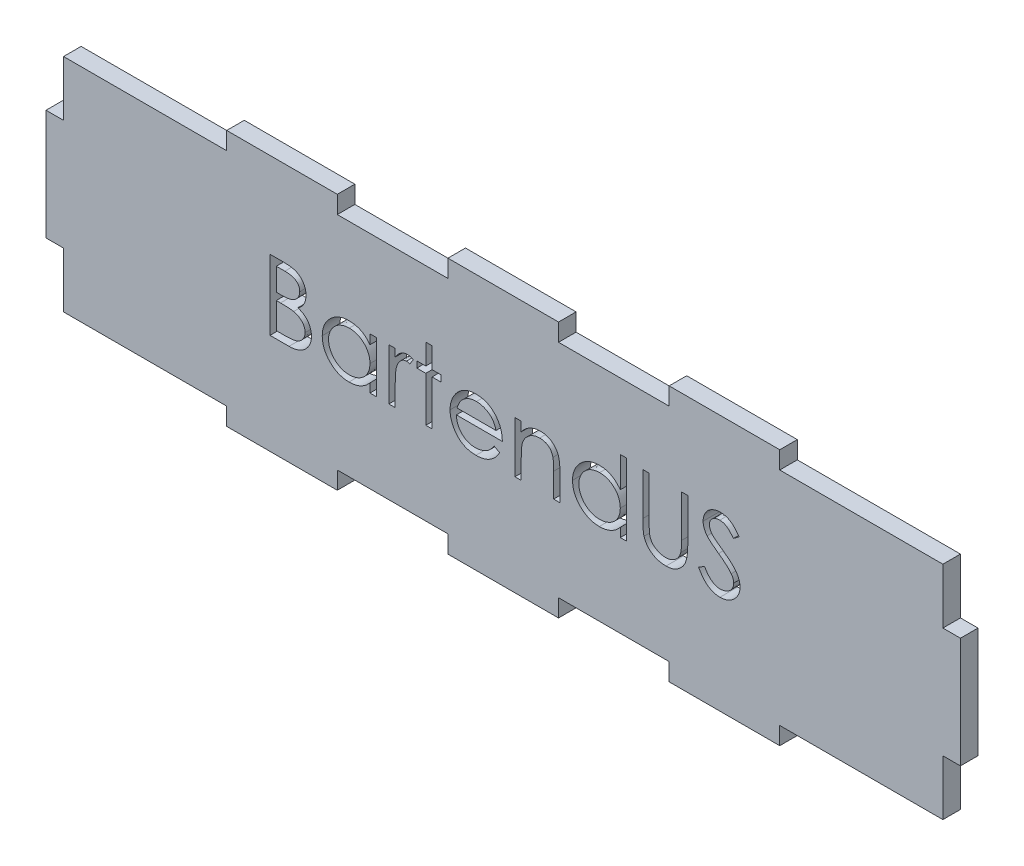
from build123d import *

# Parameters (mm, degrees)
ESQUISSE1_W             = 165.35
ESQUISSE1_H             = 46.35
BOSS_EXTRU_1_DEPTH      = 3.175
ESQUISSE3_W             = 3.175
ESQUISSE3_H             = 13.175
ENL_V_MAT_EXTRU_1_DEPTH = 86.920410119
ESQUISSE5_W             = 20
ESQUISSE5_H             = 3.175
ESQUISSE5_W_2           = 29.5
ENL_V_MAT_EXTRU_2_DEPTH = 86.920410119
ENL_V_MAT_EXTRU_3_DEPTH = 86.920410119


with BuildPart() as part:
    # Esquisse1 → Boss.-Extru.1 (new body)
    with BuildSketch(Plane.XY):
        Rectangle(ESQUISSE1_W, ESQUISSE1_H)
    extrude(amount=BOSS_EXTRU_1_DEPTH)

    # Esquisse3 → Enlèv. mat.-Extru.1 (cut, through all)
    with BuildSketch(Plane.XY.offset(3.175)):
        with Locations((-81.0875, -16.5875)):
            Rectangle(ESQUISSE3_W, ESQUISSE3_H)
        with Locations((-81.0875, 16.5875)):
            Rectangle(ESQUISSE3_W, ESQUISSE3_H)
    enl_v_mat_extru_1 = extrude(amount=-ENL_V_MAT_EXTRU_1_DEPTH, mode=Mode.SUBTRACT)

    # Symétrie1: Enlèv. mat.-Extru.1 across plane
    add(enl_v_mat_extru_1.mirror(Plane(origin=(0, 0, 0), x_dir=(0, 0, 1), z_dir=(1, 0, 0))), mode=Mode.SUBTRACT)

    # Esquisse5 → Enlèv. mat.-Extru.2 (cut, through all)
    with BuildSketch(Plane.XY.offset(3.175)):
        with Locations((-20, -21.5875)):
            Rectangle(ESQUISSE5_W, ESQUISSE5_H)
        with Locations((20, -21.5875)):
            Rectangle(ESQUISSE5_W, ESQUISSE5_H)
        with Locations((64.75, -21.5875)):
            Rectangle(ESQUISSE5_W_2, ESQUISSE5_H)
        with Locations((-64.75, -21.5875)):
            Rectangle(ESQUISSE5_W_2, ESQUISSE5_H)
    enl_v_mat_extru_2 = extrude(amount=-ENL_V_MAT_EXTRU_2_DEPTH, mode=Mode.SUBTRACT)

    # Symétrie2: Enlèv. mat.-Extru.2 across plane
    add(enl_v_mat_extru_2.mirror(Plane.ZX), mode=Mode.SUBTRACT)

    # Esquisse9 → Enlèv. mat.-Extru.3 (cut, through all)
    # profile 1 of 9: a face of its own
    with BuildSketch(Plane.XY.offset(3.175)):
        with BuildLine():
            Line((-42.170512821, 7.7), (-39.692588141, 7.7))
            add(Edge.make_bspline(
                [(-39.692588141, 7.7), (-39.57129052, 7.699362277), (-39.336185543, 7.698126211), (-38.994303568, 7.678955993), (-38.674086455, 7.652816962), (-38.375441338, 7.611342054), (-38.098506218, 7.561297606), (-37.842446506, 7.500693873), (-37.608076452, 7.428025875), (-37.32826738, 7.312469369), (-37.009240982, 7.140753872), (-36.663806814, 6.887013079), (-36.368425717, 6.576652427), (-36.113749652, 6.22655822), (-35.911271304, 5.841436991), (-35.764788425, 5.430467935), (-35.672049848, 4.9989519), (-35.662512387, 4.702703797), (-35.657692308, 4.552984776)],
                knots=[0, 0, 0, 0, 1.001505555, 1.941167018, 2.826882275, 3.653841531, 4.429895133, 5.150066043, 5.825578002, 6.45369114, 7.647487171, 8.808567382, 9.977351308, 11.170798116, 12.373658725, 13.556498008, 14.765093433, 16, 16, 16, 16], degree=3))
            add(Edge.make_bspline(
                [(-35.657692308, 4.552984776), (-35.661659129, 4.412731216), (-35.669454307, 4.137119746), (-35.743995176, 3.734006835), (-35.860692459, 3.350280984), (-36.022908649, 2.987342614), (-36.233735892, 2.653392075), (-36.48359322, 2.345735424), (-36.785043332, 2.077398731), (-37.010897374, 1.927383056), (-37.125620994, 1.851181891)],
                knots=[0, 0, 0, 0, 1.044552857, 2.05264487, 3.044412934, 4.028983338, 5.005914585, 5.980388656, 6.974128949, 8, 8, 8, 8], degree=3))
            add(Edge.make_bspline(
                [(-37.125620994, 1.851181891), (-36.981347442, 1.795791752), (-36.705316399, 1.689816695), (-36.325455725, 1.502453726), (-35.998177287, 1.298665496), (-35.720964786, 1.076118497), (-35.483882438, 0.836237955), (-35.276861765, 0.575506541), (-35.100217921, 0.290523048), (-34.948859599, -0.015741209), (-34.830754113, -0.340158966), (-34.742304402, -0.67968721), (-34.691622516, -1.033108453), (-34.684410217, -1.273629687), (-34.680769231, -1.395052083)],
                knots=[0, 0, 0, 0, 1.27268992, 2.434971085, 3.483601985, 4.442670788, 5.356604649, 6.2567628, 7.179492994, 8.113709626, 9.066344395, 10.018646069, 10.999752585, 12, 12, 12, 12], degree=3))
            add(Edge.make_bspline(
                [(-34.680769231, -1.395052083), (-34.684313786, -1.519029019), (-34.691287799, -1.762957114), (-34.742740839, -2.121297174), (-34.829859599, -2.463743409), (-34.949860616, -2.792510786), (-35.106478157, -3.106963274), (-35.297079628, -3.407457117), (-35.52434273, -3.690973117), (-35.778570855, -3.960661692), (-36.066179211, -4.203151092), (-36.376479236, -4.419108085), (-36.71337874, -4.596712367), (-37.071344547, -4.745904788), (-37.454392208, -4.859868051), (-37.860801669, -4.939597105), (-38.290222421, -4.993318239), (-38.584897804, -4.997734954), (-38.736017628, -5)],
                knots=[0, 0, 0, 0, 0.978564426, 1.925352924, 2.850884081, 3.763762016, 4.682927383, 5.618979971, 6.567305752, 7.547517671, 8.540179244, 9.531824382, 10.526200242, 11.540722885, 12.589160233, 13.674978461, 14.80764778, 16, 16, 16, 16], degree=3))
            Line((-38.736017628, -5), (-42.170512821, -5))
            Line((-42.170512821, -5), (-42.170512821, 7.7))
        make_face()
        with BuildLine():
            Line((-41.030769231, 6.397435897), (-41.030769231, 2.326923077))
            Line((-41.030769231, 2.326923077), (-40.265004006, 2.326923077))
            add(Edge.make_bspline(
                [(-40.265004006, 2.326923077), (-40.153066949, 2.328374226), (-39.936781743, 2.331178142), (-39.623563832, 2.339210047), (-39.33282448, 2.36170009), (-39.065065543, 2.38418367), (-38.820708675, 2.420740031), (-38.600295235, 2.464254305), (-38.40036604, 2.510275132), (-38.169808261, 2.588541556), (-37.908286419, 2.704211977), (-37.629492013, 2.883724068), (-37.383712652, 3.097535293), (-37.17616857, 3.344245354), (-37.006309806, 3.615902657), (-36.888331468, 3.908172766), (-36.808331323, 4.213771531), (-36.801104909, 4.423569191), (-36.797435897, 4.530088141)],
                knots=[0, 0, 0, 0, 1.156816544, 2.235205308, 3.236616184, 4.169592532, 5.011045266, 5.787822928, 6.49130361, 7.128639758, 8.301311294, 9.436451833, 10.541879658, 11.654887649, 12.756523258, 13.837046038, 14.901820046, 16, 16, 16, 16], degree=3))
            add(Edge.make_bspline(
                [(-36.797435897, 4.530088141), (-36.79934518, 4.600575941), (-36.803090446, 4.738845456), (-36.833763858, 4.940410256), (-36.885897628, 5.129980443), (-36.952860349, 5.31015393), (-37.046436448, 5.475296929), (-37.156612444, 5.631119382), (-37.289729091, 5.772314783), (-37.441248483, 5.904284106), (-37.6154512, 6.021285678), (-37.812233316, 6.123759304), (-38.034257173, 6.206275837), (-38.277780961, 6.278543019), (-38.546553193, 6.329300542), (-38.837472287, 6.371585692), (-39.152921124, 6.39311307), (-39.371161925, 6.395962815), (-39.483974359, 6.397435897)],
                knots=[0, 0, 0, 0, 0.91205012, 1.789085906, 2.630437955, 3.453916878, 4.269457761, 5.079663411, 5.91843418, 6.774407191, 7.675494373, 8.627863946, 9.638891023, 10.736472738, 11.911756761, 13.175263542, 14.539845004, 16, 16, 16, 16], degree=3))
            Line((-39.483974359, 6.397435897), (-41.030769231, 6.397435897))
        make_face(mode=Mode.SUBTRACT)
        with BuildLine():
            Line((-41.030769231, 1.024358974), (-41.030769231, -3.697435897))
            Line((-41.030769231, -3.697435897), (-39.407652244, -3.697435897))
            add(Edge.make_bspline(
                [(-39.407652244, -3.697435897), (-39.291469284, -3.696043443), (-39.067541946, -3.693359669), (-38.744231768, -3.684598286), (-38.444573077, -3.664669171), (-38.16993327, -3.633297088), (-37.91734677, -3.599266715), (-37.689843677, -3.553505782), (-37.485579803, -3.501076696), (-37.248727315, -3.420035557), (-36.982014585, -3.294136934), (-36.694592335, -3.104311027), (-36.439045772, -2.878166453), (-36.222038117, -2.616434279), (-36.044190987, -2.331840607), (-35.914812621, -2.030141765), (-35.835017227, -1.716322852), (-35.825357356, -1.502357923), (-35.820512821, -1.395052083)],
                knots=[0, 0, 0, 0, 1.160039823, 2.235823828, 3.228722157, 4.157150951, 4.99529583, 5.772374946, 6.472645482, 7.099169577, 8.269452708, 9.405989375, 10.527446681, 11.663510218, 12.788923519, 13.866172445, 14.929861265, 16, 16, 16, 16], degree=3))
            add(Edge.make_bspline(
                [(-35.820512821, -1.395052083), (-35.821514685, -1.327947676), (-35.823502253, -1.194821262), (-35.853476485, -0.999183861), (-35.897069669, -0.80967855), (-35.953426586, -0.625790748), (-36.035502939, -0.450845069), (-36.131320973, -0.281381495), (-36.243666631, -0.117176013), (-36.418724033, 0.090422735), (-36.673348091, 0.329607325), (-37.035141247, 0.563786262), (-37.446520728, 0.752645448), (-37.74488906, 0.832834976), (-37.899018429, 0.874258814)],
                knots=[0, 0, 0, 0, 0.723448775, 1.435228256, 2.130040452, 2.821711965, 3.505591119, 4.210454504, 4.921174351, 5.648778258, 7.137944449, 8.670945889, 10.280296675, 12, 12, 12, 12], degree=3))
            add(Edge.make_bspline(
                [(-37.899018429, 0.874258814), (-37.96080972, 0.886795833), (-38.094785984, 0.913978676), (-38.31325349, 0.942672343), (-38.5626665, 0.968235846), (-38.84360094, 0.987144903), (-39.156412249, 1.006690361), (-39.501768497, 1.01429157), (-39.878259325, 1.023360313), (-40.13948879, 1.024017572), (-40.275180288, 1.024358974)],
                knots=[0, 0, 0, 0, 0.634451884, 1.375622551, 2.216452059, 3.157844607, 4.20941857, 5.370758133, 6.634282058, 8, 8, 8, 8], degree=3))
            Line((-40.275180288, 1.024358974), (-41.030769231, 1.024358974))
        make_face(mode=Mode.SUBTRACT)
    # profile 2 of 9: a face of its own
    with BuildSketch(Plane.XY.offset(3.175)):
        with BuildLine():
            Line((-22.957692308, 4.280769231), (-22.957692308, -5))
            Line((-22.957692308, -5), (-24.097435897, -5))
            Line((-24.097435897, -5), (-24.097435897, -3.394691506))
            add(Edge.make_bspline(
                [(-24.097435897, -3.394691506), (-24.225955509, -3.539978033), (-24.476763147, -3.823506517), (-24.89564949, -4.193918971), (-25.339671164, -4.500091738), (-25.806673101, -4.747378575), (-26.296233584, -4.933132608), (-26.807267386, -5.065162385), (-27.339982968, -5.150048587), (-27.703755798, -5.158525009), (-27.888100962, -5.162820513)],
                knots=[0, 0, 0, 0, 1.074387032, 2.096679803, 3.090159297, 4.057316773, 5.018401886, 5.985159533, 6.978961417, 8, 8, 8, 8], degree=3))
            add(Edge.make_bspline(
                [(-27.888100962, -5.162820513), (-28.051996108, -5.158370533), (-28.375204595, -5.149594977), (-28.85065296, -5.081514618), (-29.308187694, -4.972183505), (-29.748241143, -4.820143135), (-30.167965785, -4.618464154), (-30.570955279, -4.377014482), (-30.955121904, -4.08948347), (-31.31461006, -3.760778339), (-31.64565189, -3.403745099), (-31.936159936, -3.022942687), (-32.178378255, -2.620017755), (-32.380925405, -2.20007174), (-32.536940712, -1.759871889), (-32.645702184, -1.300940451), (-32.713703234, -0.823820053), (-32.722475163, -0.498919497), (-32.726923077, -0.334174679)],
                knots=[0, 0, 0, 0, 1.033919861, 2.038935746, 3.024066025, 3.998881131, 4.97069526, 5.957263378, 6.95902576, 7.993208707, 9.027059324, 10.027763471, 11.009749337, 11.988697705, 12.965288445, 13.950418724, 14.960734635, 16, 16, 16, 16], degree=3))
            add(Edge.make_bspline(
                [(-32.726923077, -0.334174679), (-32.722376581, -0.172834955), (-32.713388403, 0.146124976), (-32.646429577, 0.615221966), (-32.533831345, 1.067045369), (-32.37581487, 1.500140563), (-32.173188347, 1.915031603), (-31.926706432, 2.312011922), (-31.636351322, 2.692175164), (-31.301606874, 3.046582187), (-30.938986422, 3.37395413), (-30.551060455, 3.658466952), (-30.147478835, 3.904182375), (-29.721981625, 4.098867846), (-29.280866702, 4.256380883), (-28.820207056, 4.365357653), (-28.341919327, 4.429573647), (-28.017196685, 4.43887282), (-27.852483974, 4.443589744)],
                knots=[0, 0, 0, 0, 1.020392517, 2.01726096, 2.990465484, 3.961182959, 4.928053699, 5.906110375, 6.912531644, 7.948652711, 8.985773172, 9.998621852, 10.987621588, 11.969261332, 12.953316658, 13.946091881, 14.958173133, 16, 16, 16, 16], degree=3))
            add(Edge.make_bspline(
                [(-27.852483974, 4.443589744), (-27.663073057, 4.438372759), (-27.291647188, 4.4281425), (-26.748348412, 4.343006318), (-26.234381306, 4.199175308), (-25.745778372, 4.003531815), (-25.284294168, 3.743549284), (-24.854297625, 3.41559914), (-24.451288585, 3.02174969), (-24.217680098, 2.719234077), (-24.097435897, 2.563521635)],
                knots=[0, 0, 0, 0, 1.038897134, 2.037228247, 3.008116434, 3.962042015, 4.918381754, 5.904844433, 6.921570401, 8, 8, 8, 8], degree=3))
            Line((-24.097435897, 2.563521635), (-24.097435897, 4.280769231))
            Line((-24.097435897, 4.280769231), (-22.957692308, 4.280769231))
        make_face()
        with BuildLine():
            add(Edge.make_bspline(
                [(-27.837219551, 3.303846154), (-28.003823006, 3.297918383), (-28.332671726, 3.286217905), (-28.81543139, 3.19487408), (-29.277397207, 3.042892837), (-29.716258677, 2.835041367), (-30.125083348, 2.573679952), (-30.490457525, 2.257553789), (-30.815369613, 1.895288052), (-31.088631029, 1.488517538), (-31.311390832, 1.05244275), (-31.468025491, 0.596605503), (-31.571328189, 0.129227442), (-31.581881963, -0.187774304), (-31.587179487, -0.346895032)],
                knots=[0, 0, 0, 0, 1.031046209, 2.035121221, 3.029706178, 4.034933723, 5.034054252, 6.02443088, 7.017295772, 8.038157696, 9.050218397, 10.03989886, 11.016116709, 12, 12, 12, 12], degree=3))
            add(Edge.make_bspline(
                [(-31.587179487, -0.346895032), (-31.580412589, -0.50506485), (-31.566905315, -0.820784512), (-31.46983851, -1.288799748), (-31.306988684, -1.744744415), (-31.084767485, -2.184748591), (-30.806504589, -2.593268041), (-30.483965764, -2.962439343), (-30.114031886, -3.279901563), (-29.704266361, -3.545649331), (-29.266631725, -3.760324763), (-28.806405745, -3.909697227), (-28.332239858, -4.006136602), (-28.009832818, -4.017401418), (-27.847395833, -4.023076923)],
                knots=[0, 0, 0, 0, 0.979072187, 1.954306742, 2.945804271, 3.96968567, 4.997920485, 5.998718438, 6.996577872, 8.005894225, 9.015743152, 10.005417472, 10.995077863, 12, 12, 12, 12], degree=3))
            add(Edge.make_bspline(
                [(-27.847395833, -4.023076923), (-27.682489952, -4.017053625), (-27.354508509, -4.005073884), (-26.870316626, -3.913339007), (-26.400434904, -3.761777939), (-25.951264104, -3.551686822), (-25.532831285, -3.29131013), (-25.157281844, -2.9864844), (-24.839723901, -2.631961417), (-24.570510718, -2.242338288), (-24.359417063, -1.815211901), (-24.205652506, -1.360427837), (-24.114742619, -0.877970265), (-24.103284571, -0.548264016), (-24.097435897, -0.379967949)],
                knots=[0, 0, 0, 0, 1.01762866, 2.023962475, 3.030623092, 4.058876274, 5.077231937, 6.066672613, 7.034107872, 8.005628644, 8.981990164, 9.965428785, 10.961468474, 12, 12, 12, 12], degree=3))
            add(Edge.make_bspline(
                [(-24.097435897, -0.379967949), (-24.100918079, -0.251742107), (-24.107772115, 0.000646929), (-24.160134467, 0.371223921), (-24.243428057, 0.725857727), (-24.360798445, 1.064921199), (-24.514981106, 1.386539683), (-24.700937285, 1.69302247), (-24.92193706, 1.982775551), (-25.174422843, 2.25180898), (-25.450793721, 2.497196429), (-25.743236768, 2.716232388), (-26.055216793, 2.896168792), (-26.381487184, 3.045089977), (-26.722614026, 3.163596036), (-27.081373132, 3.242654239), (-27.453951171, 3.296938832), (-27.708118286, 3.301519471), (-27.837219551, 3.303846154)],
                knots=[0, 0, 0, 0, 1.050140795, 2.067009409, 3.05949893, 4.030605086, 5.00011959, 5.97591094, 6.962425594, 7.979863591, 8.993523472, 9.986985069, 10.967611495, 11.937549037, 12.921786183, 13.919465291, 14.943216303, 16, 16, 16, 16], degree=3))
        make_face(mode=Mode.SUBTRACT)
    # profile 3 of 9: a face of its own
    with BuildSketch(Plane.XY.offset(3.175)):
        with BuildLine():
            Line((-20.678205128, 4.280769231), (-19.538461538, 4.280769231))
            Line((-19.538461538, 4.280769231), (-19.538461538, 2.914603365))
            add(Edge.make_bspline(
                [(-19.538461538, 2.914603365), (-19.454319471, 3.041805942), (-19.293398421, 3.285079883), (-19.025925791, 3.606822775), (-18.751956561, 3.873214515), (-18.470179167, 4.085498712), (-18.17852149, 4.244477743), (-17.883384551, 4.360929613), (-17.580124989, 4.429790157), (-17.376337435, 4.43898372), (-17.274238782, 4.443589744)],
                knots=[0, 0, 0, 0, 1.2804753, 2.448899062, 3.506932113, 4.484331642, 5.4025378, 6.288909075, 7.142734305, 8, 8, 8, 8], degree=3))
            add(Edge.make_bspline(
                [(-17.274238782, 4.443589744), (-17.195040397, 4.439269833), (-17.032084574, 4.430381336), (-16.785404891, 4.367930629), (-16.531247223, 4.268224662), (-16.367444846, 4.174461568), (-16.282051282, 4.125580929)],
                knots=[0, 0, 0, 0, 0.901110191, 1.854092781, 2.881294221, 4, 4, 4, 4], degree=3))
            Line((-16.282051282, 4.125580929), (-16.907892628, 3.138481571))
            add(Edge.make_bspline(
                [(-16.907892628, 3.138481571), (-16.962716791, 3.162939108), (-17.066783546, 3.209364195), (-17.219018687, 3.26430806), (-17.35937668, 3.296660098), (-17.448797592, 3.301561272), (-17.490484776, 3.303846154)],
                knots=[0, 0, 0, 0, 1.180555205, 2.24091978, 3.179933427, 4, 4, 4, 4], degree=3))
            add(Edge.make_bspline(
                [(-17.490484776, 3.303846154), (-17.58194558, 3.297750018), (-17.768499109, 3.285315669), (-18.042400007, 3.187566281), (-18.308182724, 3.029631838), (-18.519262756, 2.854476661), (-18.682701788, 2.685574653), (-18.799324892, 2.53807902), (-18.906305145, 2.3726937), (-19.008522802, 2.192245991), (-19.101654784, 1.993654835), (-19.188576012, 1.778904318), (-19.267166744, 1.547745708), (-19.311980487, 1.386700563), (-19.334935897, 1.304206731)],
                knots=[0, 0, 0, 0, 1.125678352, 2.296057538, 3.5422874, 4.923748041, 5.663163013, 6.437101912, 7.23742474, 8.08941207, 8.991984279, 9.93940061, 10.944477711, 12, 12, 12, 12], degree=3))
            add(Edge.make_bspline(
                [(-19.334935897, 1.304206731), (-19.352107725, 1.230629558), (-19.390142018, 1.067661712), (-19.427122741, 0.794254208), (-19.463660706, 0.471225503), (-19.489411292, 0.097676437), (-19.513280188, -0.325460145), (-19.526742486, -0.798828862), (-19.538002454, -1.322915593), (-19.538303868, -1.689308246), (-19.538461538, -1.880969551)],
                knots=[0, 0, 0, 0, 0.566838948, 1.255505196, 2.06880316, 3.007127437, 4.065329342, 5.249902469, 6.561414163, 8, 8, 8, 8], degree=3))
            Line((-19.538461538, -1.880969551), (-19.538461538, -5))
            Line((-19.538461538, -5), (-20.678205128, -5))
            Line((-20.678205128, -5), (-20.678205128, 4.280769231))
        make_face()
    # profile 4 of 9: a face of its own
    with BuildSketch(Plane.XY.offset(3.175)):
        Polygon((-14.002564103, 8.025641026), (-12.862820513, 8.025641026), (-12.862820513, 4.280769231), (-11.234615385, 4.280769231), (-11.234615385, 3.141025641), (-12.862820513, 3.141025641), (-12.862820513, -5), (-14.002564103, -5), (-14.002564103, 3.141025641), (-15.630769231, 3.141025641), (-15.630769231, 4.280769231), (-14.002564103, 4.280769231), align=None)
    # profile 5 of 9: a face of its own
    with BuildSketch(Plane.XY.offset(3.175)):
        with BuildLine():
            Line((-1.663822115, -2.069230769), (-0.651282051, -2.600941506))
            add(Edge.make_bspline(
                [(-0.651282051, -2.600941506), (-0.731969125, -2.744064451), (-0.888954219, -3.022525024), (-1.158922647, -3.405092061), (-1.441922453, -3.749253773), (-1.75072828, -4.045815661), (-2.076101115, -4.304356401), (-2.41984532, -4.530553651), (-2.783750458, -4.723297996), (-3.167833745, -4.88568574), (-3.575320688, -5.010543047), (-4.007198762, -5.098732649), (-4.464295331, -5.153245652), (-4.777608612, -5.15957802), (-4.938040865, -5.162820513)],
                knots=[0, 0, 0, 0, 1.120438281, 2.179929193, 3.190490725, 4.156257408, 5.095198341, 6.022838206, 6.959905092, 7.901321166, 8.864066838, 9.862729781, 10.905609505, 12, 12, 12, 12], degree=3))
            add(Edge.make_bspline(
                [(-4.938040865, -5.162820513), (-5.116356041, -5.158657905), (-5.46419729, -5.150537864), (-5.97052723, -5.080533778), (-6.447246834, -4.966334077), (-6.8943293, -4.806801969), (-7.31067976, -4.598422822), (-7.697125719, -4.344569845), (-8.055699427, -4.046547092), (-8.375101557, -3.70177314), (-8.662643646, -3.332812895), (-8.916374478, -2.9483444), (-9.128491442, -2.549334985), (-9.301039485, -2.138324798), (-9.440394281, -1.717904384), (-9.537519177, -1.284248488), (-9.59350712, -0.838530796), (-9.60208668, -0.537006178), (-9.606410256, -0.38505609)],
                knots=[0, 0, 0, 0, 1.145258523, 2.234067595, 3.276747158, 4.290159414, 5.277019952, 6.260822364, 7.254936242, 8.264827045, 9.274100331, 10.257902744, 11.220704747, 12.172965371, 13.118907548, 14.062713208, 15.023725156, 16, 16, 16, 16], degree=3))
            add(Edge.make_bspline(
                [(-9.606410256, -0.38505609), (-9.602567086, -0.242471991), (-9.594950431, 0.040110864), (-9.546941574, 0.458360126), (-9.461857768, 0.864863368), (-9.345103678, 1.259958364), (-9.194332013, 1.642983593), (-9.009883675, 2.014172167), (-8.791471333, 2.373129103), (-8.622841916, 2.599563331), (-8.537900641, 2.713621795)],
                knots=[0, 0, 0, 0, 1.024358464, 2.0301432, 3.019427413, 4.004406732, 4.986367066, 5.972626655, 6.978780325, 8, 8, 8, 8], degree=3))
            add(Edge.make_bspline(
                [(-8.537900641, 2.713621795), (-8.422847049, 2.851031695), (-8.196384472, 3.121498698), (-7.813365696, 3.476874909), (-7.39861927, 3.774576607), (-6.957342798, 4.021345358), (-6.484407592, 4.208846877), (-5.986171022, 4.34857439), (-5.456959894, 4.426871744), (-5.095172379, 4.437931026), (-4.91005609, 4.443589744)],
                knots=[0, 0, 0, 0, 1.030682036, 2.02871468, 2.997146059, 3.962720338, 4.930598197, 5.918074684, 6.934738563, 8, 8, 8, 8], degree=3))
            add(Edge.make_bspline(
                [(-4.91005609, 4.443589744), (-4.719746208, 4.43867648), (-4.346401601, 4.429037778), (-3.801999333, 4.339679368), (-3.286884733, 4.197974385), (-2.801263932, 3.997844916), (-2.345087694, 3.7396374), (-1.921321171, 3.419808432), (-1.522717112, 3.048177087), (-1.290820268, 2.762379156), (-1.172816506, 2.616947115)],
                knots=[0, 0, 0, 0, 1.056321875, 2.072262726, 3.055038591, 4.01806755, 4.982017516, 5.957941055, 6.960871419, 8, 8, 8, 8], degree=3))
            add(Edge.make_bspline(
                [(-1.172816506, 2.616947115), (-1.09252733, 2.507351263), (-0.932483407, 2.288889061), (-0.732015358, 1.932668005), (-0.557998525, 1.559975277), (-0.418904638, 1.164786485), (-0.30627559, 0.751784008), (-0.22478942, 0.318015346), (-0.177002518, -0.136390333), (-0.167609245, -0.446003834), (-0.162820513, -0.603846154)],
                knots=[0, 0, 0, 0, 0.94817472, 1.890038105, 2.849395472, 3.817997239, 4.812318967, 5.836947057, 6.897266129, 8, 8, 8, 8], degree=3))
            Line((-0.162820513, -0.603846154), (-8.466666667, -0.603846154))
            add(Edge.make_bspline(
                [(-8.466666667, -0.603846154), (-8.461080095, -0.726130696), (-8.450094326, -0.966598315), (-8.398876521, -1.318463728), (-8.318145256, -1.653646998), (-8.204683229, -1.969634036), (-8.067280676, -2.270551927), (-7.89896679, -2.554168461), (-7.698163265, -2.819191808), (-7.474187156, -3.067992564), (-7.224878553, -3.289555897), (-6.962595442, -3.487863771), (-6.683581649, -3.654072651), (-6.390037174, -3.788982536), (-6.082436697, -3.894596883), (-5.760683303, -3.96668869), (-5.425410138, -4.014974477), (-5.196861903, -4.020343548), (-5.080508814, -4.023076923)],
                knots=[0, 0, 0, 0, 1.094153842, 2.151609401, 3.174256925, 4.172055639, 5.149267565, 6.128595816, 7.11444997, 8.118368179, 9.117203808, 10.09244225, 11.054858984, 12.015122123, 12.976791628, 13.957293641, 14.960065497, 16, 16, 16, 16], degree=3))
            add(Edge.make_bspline(
                [(-5.080508814, -4.023076923), (-4.966748936, -4.020870546), (-4.741027514, -4.016492671), (-4.404873546, -3.973922594), (-4.074167261, -3.905087594), (-3.750277408, -3.811143916), (-3.439777481, -3.696565052), (-3.152229342, -3.558306112), (-2.887778274, -3.405362745), (-2.640610995, -3.230430495), (-2.400867676, -3.016315074), (-2.163042083, -2.749122601), (-1.908038226, -2.433119286), (-1.748418847, -2.195282155), (-1.663822115, -2.069230769)],
                knots=[0, 0, 0, 0, 0.99110716, 1.966546729, 2.947904876, 3.932708344, 4.903319531, 5.828989031, 6.710028674, 7.56322171, 8.463672341, 9.504779593, 10.677557249, 12, 12, 12, 12], degree=3))
        make_face()
        with BuildLine():
            add(Edge.make_bspline(
                [(-1.302564103, 0.535897436), (-1.344280426, 0.687074149), (-1.42457092, 0.978040658), (-1.592342871, 1.380960461), (-1.781288176, 1.739056558), (-2.00488703, 2.04958837), (-2.258229263, 2.325372546), (-2.550856068, 2.566377126), (-2.879009167, 2.781977591), (-3.240992335, 2.963959518), (-3.624321098, 3.11886272), (-4.025663566, 3.222730997), (-4.435176111, 3.293885622), (-4.712160521, 3.300511787), (-4.851542468, 3.303846154)],
                knots=[0, 0, 0, 0, 1.154881502, 2.222775134, 3.210006277, 4.132804581, 5.035138423, 5.962687519, 6.919655026, 7.923214229, 8.944639381, 9.960483929, 10.97369054, 12, 12, 12, 12], degree=3))
            add(Edge.make_bspline(
                [(-4.851542468, 3.303846154), (-4.965296145, 3.30162666), (-5.190163249, 3.297239187), (-5.521455696, 3.255619004), (-5.839607746, 3.186821852), (-6.146966933, 3.092606153), (-6.439505512, 2.967026366), (-6.723240814, 2.81976723), (-6.990958252, 2.640002054), (-7.158385238, 2.502991352), (-7.24296875, 2.433774038)],
                knots=[0, 0, 0, 0, 1.04873581, 2.073130211, 3.073294108, 4.04793562, 5.032784715, 6.005352987, 6.992311501, 8, 8, 8, 8], degree=3))
            add(Edge.make_bspline(
                [(-7.24296875, 2.433774038), (-7.303541516, 2.379003236), (-7.426126032, 2.268160481), (-7.589921638, 2.077191645), (-7.74675021, 1.871264548), (-7.889475179, 1.642500811), (-8.020385278, 1.393505413), (-8.142885767, 1.126378565), (-8.253145034, 0.839093206), (-8.31517949, 0.63889607), (-8.347095353, 0.535897436)],
                knots=[0, 0, 0, 0, 0.879870761, 1.780643979, 2.707998968, 3.669668524, 4.684282772, 5.740141944, 6.837334558, 8, 8, 8, 8], degree=3))
            Line((-8.347095353, 0.535897436), (-1.302564103, 0.535897436))
        make_face(mode=Mode.SUBTRACT)
    # profile 6 of 9: a face of its own
    with BuildSketch(Plane.XY.offset(3.175)):
        with BuildLine():
            Line((2.116666667, 4.280769231), (3.256410256, 4.280769231))
            Line((3.256410256, 4.280769231), (3.256410256, 2.606770833))
            add(Edge.make_bspline(
                [(3.256410256, 2.606770833), (3.378103961, 2.758600142), (3.614254841, 3.053230212), (4.007535136, 3.44047344), (4.42316586, 3.759588971), (4.858601701, 4.013965595), (5.314433766, 4.205723352), (5.787883488, 4.344211159), (6.281785422, 4.427250394), (6.617662093, 4.438100659), (6.787580128, 4.443589744)],
                knots=[0, 0, 0, 0, 1.12780773, 2.188550248, 3.19190651, 4.159438251, 5.104880172, 6.052711206, 7.014878035, 8, 8, 8, 8], degree=3))
            add(Edge.make_bspline(
                [(6.787580128, 4.443589744), (6.959322715, 4.437257177), (7.295464384, 4.424862817), (7.784879063, 4.326830824), (8.241982521, 4.15938947), (8.665144909, 3.930019957), (9.046606511, 3.644790754), (9.38161383, 3.312494231), (9.658703327, 2.930274729), (9.844476616, 2.575679277), (9.966852538, 2.261122795), (10.043895591, 1.991713158), (10.109322295, 1.691564438), (10.166043209, 1.361583644), (10.204423015, 0.999458782), (10.234693616, 0.6066743), (10.256387735, 0.183357426), (10.257248458, -0.109419765), (10.257692308, -0.260396635)],
                knots=[0, 0, 0, 0, 1.235846778, 2.418850247, 3.575807741, 4.728682307, 5.871620074, 6.994088408, 8.11269785, 9.256955736, 9.865816715, 10.540099792, 11.271859618, 12.076849838, 12.949306005, 13.892391288, 14.913166135, 16, 16, 16, 16], degree=3))
            Line((10.257692308, -0.260396635), (10.257692308, -5))
            Line((10.257692308, -5), (9.117948718, -5))
            Line((9.117948718, -5), (9.117948718, -0.634375))
            add(Edge.make_bspline(
                [(9.117948718, -0.634375), (9.117247649, -0.508019271), (9.115906623, -0.266322266), (9.111676991, 0.079731046), (9.101481407, 0.393553774), (9.087154671, 0.67439565), (9.066185046, 0.921986999), (9.044331498, 1.136832089), (9.017607154, 1.318658143), (8.993793155, 1.428114299), (8.983112981, 1.477203526)],
                knots=[0, 0, 0, 0, 1.430800155, 2.736877192, 3.918605307, 4.986035426, 5.920637409, 6.731861385, 7.431261377, 8, 8, 8, 8], degree=3))
            add(Edge.make_bspline(
                [(8.983112981, 1.477203526), (8.944557481, 1.621298397), (8.870350072, 1.898636442), (8.686983905, 2.274826235), (8.455429592, 2.59485966), (8.172771681, 2.85675805), (7.841740464, 3.060577943), (7.463254546, 3.201997721), (7.040966335, 3.290448755), (6.743951861, 3.299255777), (6.589142628, 3.303846154)],
                knots=[0, 0, 0, 0, 1.084156227, 2.086665306, 3.027808233, 3.945421172, 4.874247719, 5.839848303, 6.874090471, 8, 8, 8, 8], degree=3))
            add(Edge.make_bspline(
                [(6.589142628, 3.303846154), (6.497457033, 3.302118937), (6.31601361, 3.298700819), (6.046955141, 3.264406109), (5.785973141, 3.208313999), (5.530448383, 3.132590657), (5.285491531, 3.028587566), (5.043232532, 2.910552423), (4.812793702, 2.763420339), (4.589261375, 2.599442941), (4.381297759, 2.417726961), (4.187792074, 2.225976881), (4.015296972, 2.021776833), (3.859019207, 1.808417024), (3.724115223, 1.582967211), (3.606356875, 1.347602442), (3.506441639, 1.102012931), (3.456793012, 0.931560566), (3.431951122, 0.846274038)],
                knots=[0, 0, 0, 0, 1.023777757, 2.026029729, 3.023749952, 4.003683103, 4.997618607, 5.993177895, 7.010360494, 8.046726602, 9.087585522, 10.09234134, 11.086953743, 12.070360549, 13.043493632, 14.017870808, 15.008233677, 16, 16, 16, 16], degree=3))
            add(Edge.make_bspline(
                [(3.431951122, 0.846274038), (3.417655826, 0.783662302), (3.386535713, 0.647359826), (3.352923604, 0.423678647), (3.322416116, 0.164925309), (3.296882009, -0.128598241), (3.281259498, -0.457919674), (3.264225544, -0.821632571), (3.258024093, -1.221187229), (3.256963266, -1.499359657), (3.256410256, -1.644370994)],
                knots=[0, 0, 0, 0, 0.615963638, 1.340920617, 2.168419149, 3.115676021, 4.16674242, 5.331190069, 6.6087489, 8, 8, 8, 8], degree=3))
            Line((3.256410256, -1.644370994), (3.256410256, -5))
            Line((3.256410256, -5), (2.116666667, -5))
            Line((2.116666667, -5), (2.116666667, 4.280769231))
        make_face()
    # profile 7 of 9: a face of its own
    with BuildSketch(Plane.XY.offset(3.175)):
        with BuildLine():
            Line((22.306410256, 8.025641026), (22.306410256, -5))
            Line((22.306410256, -5), (21.166666667, -5))
            Line((21.166666667, -5), (21.166666667, -3.394691506))
            add(Edge.make_bspline(
                [(21.166666667, -3.394691506), (21.038147055, -3.539978033), (20.787339417, -3.823506517), (20.368453074, -4.193918971), (19.9244314, -4.500091738), (19.457429464, -4.747378575), (18.967868981, -4.933132608), (18.456835178, -5.065162385), (17.924119596, -5.150048587), (17.560346766, -5.158525009), (17.376001603, -5.162820513)],
                knots=[0, 0, 0, 0, 1.074387032, 2.096679803, 3.090159297, 4.057316773, 5.018401886, 5.985159533, 6.978961417, 8, 8, 8, 8], degree=3))
            add(Edge.make_bspline(
                [(17.376001603, -5.162820513), (17.212106456, -5.158370533), (16.888897969, -5.149594977), (16.413449604, -5.081514618), (15.95591487, -4.972183505), (15.515861421, -4.820143135), (15.096136779, -4.618464154), (14.693147285, -4.377014482), (14.30898066, -4.08948347), (13.949492504, -3.760778339), (13.618450674, -3.403745099), (13.327942628, -3.022942687), (13.085724309, -2.620017755), (12.88317716, -2.20007174), (12.727161853, -1.759871889), (12.61840038, -1.300940451), (12.55039933, -0.823820053), (12.541627401, -0.498919497), (12.537179487, -0.334174679)],
                knots=[0, 0, 0, 0, 1.033919861, 2.038935746, 3.024066025, 3.998881131, 4.97069526, 5.957263378, 6.95902576, 7.993208707, 9.027059324, 10.027763471, 11.009749337, 11.988697705, 12.965288445, 13.950418724, 14.960734635, 16, 16, 16, 16], degree=3))
            add(Edge.make_bspline(
                [(12.537179487, -0.334174679), (12.541725983, -0.172834955), (12.550714161, 0.146124976), (12.617672987, 0.615221966), (12.730271219, 1.067045369), (12.888287695, 1.500140563), (13.090914217, 1.915031603), (13.337396133, 2.312011922), (13.627751242, 2.692175164), (13.962495691, 3.046582187), (14.325116142, 3.37395413), (14.713042109, 3.658466952), (15.11662373, 3.904182375), (15.542120939, 4.098867846), (15.983235862, 4.256380883), (16.443895508, 4.365357653), (16.922183237, 4.429573647), (17.246905879, 4.43887282), (17.41161859, 4.443589744)],
                knots=[0, 0, 0, 0, 1.020392517, 2.01726096, 2.990465484, 3.961182959, 4.928053699, 5.906110375, 6.912531644, 7.948652711, 8.985773172, 9.998621852, 10.987621588, 11.969261332, 12.953316658, 13.946091881, 14.958173133, 16, 16, 16, 16], degree=3))
            add(Edge.make_bspline(
                [(17.41161859, 4.443589744), (17.601091006, 4.437903424), (17.973004304, 4.42674181), (18.516921796, 4.333464421), (19.031408269, 4.176844836), (19.51942568, 3.962427901), (19.978064628, 3.683750889), (20.410687009, 3.347195635), (20.809769352, 2.943237134), (21.045887108, 2.639846567), (21.166666667, 2.484655449)],
                knots=[0, 0, 0, 0, 1.031072012, 2.023879775, 2.993683497, 3.952812103, 4.918022106, 5.908088563, 6.929940113, 8, 8, 8, 8], degree=3))
            Line((21.166666667, 2.484655449), (21.166666667, 8.025641026))
            Line((21.166666667, 8.025641026), (22.306410256, 8.025641026))
        make_face()
        with BuildLine():
            add(Edge.make_bspline(
                [(17.426883013, 3.303846154), (17.260279558, 3.297918383), (16.931430838, 3.286217905), (16.448671174, 3.19487408), (15.986705357, 3.042892837), (15.547843887, 2.835041367), (15.139019216, 2.573679952), (14.773645039, 2.257553789), (14.448732951, 1.895288052), (14.175471535, 1.488517538), (13.952711732, 1.05244275), (13.796077073, 0.596605503), (13.692774375, 0.129227442), (13.682220601, -0.187774304), (13.676923077, -0.346895032)],
                knots=[0, 0, 0, 0, 1.031046209, 2.035121221, 3.029706178, 4.034933723, 5.034054252, 6.02443088, 7.017295772, 8.038157696, 9.050218397, 10.03989886, 11.016116709, 12, 12, 12, 12], degree=3))
            add(Edge.make_bspline(
                [(13.676923077, -0.346895032), (13.683689976, -0.50506485), (13.697197249, -0.820784512), (13.794264054, -1.288799748), (13.957113881, -1.744744415), (14.17933508, -2.184748591), (14.457597975, -2.593268041), (14.7801368, -2.962439343), (15.150070678, -3.279901563), (15.559836204, -3.545649331), (15.997470839, -3.760324763), (16.457696819, -3.909697227), (16.931862706, -4.006136602), (17.254269746, -4.017401418), (17.416706731, -4.023076923)],
                knots=[0, 0, 0, 0, 0.979072187, 1.954306742, 2.945804271, 3.96968567, 4.997920485, 5.998718438, 6.996577872, 8.005894225, 9.015743152, 10.005417472, 10.995077863, 12, 12, 12, 12], degree=3))
            add(Edge.make_bspline(
                [(17.416706731, -4.023076923), (17.581612612, -4.017053625), (17.909594055, -4.005073884), (18.393785938, -3.913339007), (18.86366766, -3.761777939), (19.31283846, -3.551686822), (19.731271279, -3.29131013), (20.10682072, -2.9864844), (20.424378663, -2.631961417), (20.693591846, -2.242338288), (20.904685501, -1.815211901), (21.058450059, -1.360427837), (21.149359945, -0.877970265), (21.160817993, -0.548264016), (21.166666667, -0.379967949)],
                knots=[0, 0, 0, 0, 1.01762866, 2.023962475, 3.030623092, 4.058876274, 5.077231937, 6.066672613, 7.034107872, 8.005628644, 8.981990164, 9.965428785, 10.961468474, 12, 12, 12, 12], degree=3))
            add(Edge.make_bspline(
                [(21.166666667, -0.379967949), (21.163184485, -0.251742107), (21.156330449, 0.000646929), (21.103968097, 0.371223921), (21.020674507, 0.725857727), (20.903304119, 1.064921199), (20.749121458, 1.386539683), (20.563165279, 1.69302247), (20.342165504, 1.982775551), (20.089679721, 2.25180898), (19.813308843, 2.497196429), (19.520865796, 2.716232388), (19.208885771, 2.896168792), (18.88261538, 3.045089977), (18.541488538, 3.163596036), (18.182729432, 3.242654239), (17.810151394, 3.296938832), (17.555984278, 3.301519471), (17.426883013, 3.303846154)],
                knots=[0, 0, 0, 0, 1.050140795, 2.067009409, 3.05949893, 4.030605086, 5.00011959, 5.97591094, 6.962425594, 7.979863591, 8.993523472, 9.986985069, 10.967611495, 11.937549037, 12.921786183, 13.919465291, 14.943216303, 16, 16, 16, 16], degree=3))
        make_face(mode=Mode.SUBTRACT)
    # profile 8 of 9: a face of its own
    with BuildSketch(Plane.XY.offset(3.175)):
        with BuildLine():
            Line((25.237179487, 7.7), (26.376923077, 7.7))
            Line((26.376923077, 7.7), (26.376923077, 0.090685096))
            add(Edge.make_bspline(
                [(26.376923077, 0.090685096), (26.376753463, -0.017013574), (26.376431592, -0.221390359), (26.37858157, -0.512286764), (26.384602707, -0.770903972), (26.388398772, -0.998238862), (26.396843668, -1.19324826), (26.403730867, -1.356988673), (26.412586601, -1.488684779), (26.423229627, -1.565541282), (26.427804487, -1.598577724)],
                knots=[0, 0, 0, 0, 1.528628734, 2.90083645, 4.128790002, 5.200304208, 6.127813768, 6.898992206, 7.526736466, 8, 8, 8, 8], degree=3))
            add(Edge.make_bspline(
                [(26.427804487, -1.598577724), (26.446591266, -1.717764551), (26.483106257, -1.949422454), (26.57616597, -2.279289648), (26.706132331, -2.576583797), (26.860139943, -2.85058191), (27.063095419, -3.093657588), (27.306222532, -3.317582728), (27.600781864, -3.513423277), (27.928298919, -3.692496222), (28.281305352, -3.836423807), (28.642026233, -3.945256872), (29.005039329, -4.011583165), (29.248067128, -4.019263178), (29.36875, -4.023076923)],
                knots=[0, 0, 0, 0, 1.035780045, 2.013197591, 2.933192213, 3.817615948, 4.702609284, 5.640816605, 6.646850145, 7.73207398, 8.84249596, 9.914020372, 10.964143139, 12, 12, 12, 12], degree=3))
            add(Edge.make_bspline(
                [(29.36875, -4.023076923), (29.472359287, -4.019180381), (29.67897944, -4.011409801), (29.985979917, -3.963289751), (30.284974597, -3.876564842), (30.577439921, -3.764660575), (30.851582064, -3.616805031), (31.107553983, -3.446005127), (31.336023115, -3.24566852), (31.544513565, -3.023961556), (31.726068903, -2.773808567), (31.883444189, -2.500656466), (32.012352562, -2.20039455), (32.076010495, -1.989377075), (32.108713942, -1.880969551)],
                knots=[0, 0, 0, 0, 0.994687771, 1.983630487, 2.973142513, 3.978332533, 4.983357753, 5.956394766, 6.925816176, 7.893390482, 8.871859704, 9.88551698, 10.913711441, 12, 12, 12, 12], degree=3))
            add(Edge.make_bspline(
                [(32.108713942, -1.880969551), (32.119600111, -1.836161867), (32.143858883, -1.73631229), (32.166526732, -1.567506464), (32.190136124, -1.368336486), (32.206517564, -1.137371337), (32.222487706, -0.875384951), (32.232041999, -0.581012531), (32.23645809, -0.255322987), (32.237774101, -0.028039571), (32.238461538, 0.090685096)],
                knots=[0, 0, 0, 0, 0.558680831, 1.244966039, 2.062412453, 2.990489873, 4.051219941, 5.244515665, 6.560634259, 8, 8, 8, 8], degree=3))
            Line((32.238461538, 0.090685096), (32.238461538, 7.7))
            Line((32.238461538, 7.7), (33.378205128, 7.7))
            Line((33.378205128, 7.7), (33.378205128, 0.029627404))
            add(Edge.make_bspline(
                [(33.378205128, 0.029627404), (33.377283034, -0.108615285), (33.375483512, -0.378404299), (33.359878563, -0.773742087), (33.334997449, -1.148765762), (33.29984353, -1.503525735), (33.253263547, -1.836752542), (33.20146489, -2.151366986), (33.135499155, -2.445110703), (33.058452243, -2.720274047), (32.97037394, -2.982204338), (32.856287487, -3.23079274), (32.727747159, -3.473596419), (32.57529399, -3.706942985), (32.403984115, -3.931865621), (32.210030874, -4.147000264), (31.999848919, -4.355784804), (31.769944231, -4.552863644), (31.524106611, -4.733597986), (31.263067336, -4.892521326), (30.988831628, -5.026864167), (30.702112342, -5.137448235), (30.40278712, -5.220595495), (30.090848415, -5.282553918), (29.765586199, -5.317759397), (29.54437159, -5.322991544), (29.432351763, -5.325641026)],
                knots=[0, 0, 0, 0, 1.316592851, 2.569410997, 3.76748051, 4.895814652, 5.963796859, 6.97159953, 7.931736103, 8.829262218, 9.692595152, 10.560224239, 11.431080259, 12.30701507, 13.211635791, 14.121146779, 15.063487852, 16.031507147, 17.00238618, 17.966455255, 18.938106653, 19.907068911, 20.888905087, 21.893141452, 22.933117798, 24, 24, 24, 24], degree=3))
            add(Edge.make_bspline(
                [(29.432351763, -5.325641026), (29.310181019, -5.322793449), (29.070482457, -5.317206513), (28.717284327, -5.285192534), (28.3786871, -5.224891503), (28.051114632, -5.148111136), (27.739026657, -5.042215861), (27.438241873, -4.918488379), (27.153911802, -4.766533749), (26.881423764, -4.597466294), (26.628059648, -4.40723975), (26.395477643, -4.199902548), (26.18329377, -3.978776035), (25.9950845, -3.741466137), (25.827731576, -3.489818514), (25.683567659, -3.223121273), (25.559785316, -2.941477668), (25.49589863, -2.745704627), (25.463601763, -2.646734776)],
                knots=[0, 0, 0, 0, 1.13879206, 2.234305948, 3.301075583, 4.341971843, 5.366689343, 6.369221514, 7.369726634, 8.367512178, 9.355451585, 10.318319045, 11.268648973, 12.207971039, 13.137398894, 14.081662264, 15.030215811, 16, 16, 16, 16], degree=3))
            add(Edge.make_bspline(
                [(25.463601763, -2.646734776), (25.444816075, -2.579125148), (25.404069498, -2.432478361), (25.360434847, -2.18977596), (25.323753322, -1.91032183), (25.289261725, -1.594096843), (25.268909221, -1.240855899), (25.251065943, -0.850752118), (25.237053783, -0.4233138), (25.237136415, -0.125573129), (25.237179487, 0.029627404)],
                knots=[0, 0, 0, 0, 0.625038921, 1.35572334, 2.194682327, 3.136881307, 4.189498639, 5.346923369, 6.617055217, 8, 8, 8, 8], degree=3))
            Line((25.237179487, 0.029627404), (25.237179487, 7.7))
        make_face()
    # profile 9 of 9: a face of its own
    with BuildSketch(Plane.XY.offset(3.175)):
        with BuildLine():
            Line((35.332051282, -2.550060096), (36.405649038, -1.906410256))
            add(Edge.make_bspline(
                [(36.405649038, -1.906410256), (36.505500928, -2.073558168), (36.696813295, -2.393807115), (37.015951084, -2.826543433), (37.346633361, -3.194343259), (37.691308943, -3.495066949), (38.047873955, -3.731827195), (38.418656093, -3.899475293), (38.802405863, -4.004036118), (39.063568015, -4.016736432), (39.193950321, -4.023076923)],
                knots=[0, 0, 0, 0, 1.272034388, 2.437168799, 3.508375237, 4.49857839, 5.41946034, 6.295179144, 7.148887113, 8, 8, 8, 8], degree=3))
            add(Edge.make_bspline(
                [(39.193950321, -4.023076923), (39.305299786, -4.019975683), (39.526050362, -4.013827467), (39.851033358, -3.954751414), (40.166653041, -3.863993117), (40.466404383, -3.734014309), (40.746151327, -3.576757518), (40.991467051, -3.386815673), (41.203542947, -3.17415887), (41.377021734, -2.936913237), (41.510117862, -2.681762441), (41.612414796, -2.419866846), (41.669184063, -2.147112327), (41.677735712, -1.963468647), (41.682051282, -1.870793269)],
                knots=[0, 0, 0, 0, 1.095163259, 2.171163733, 3.241058638, 4.321873601, 5.38011039, 6.391990106, 7.366004449, 8.327778327, 9.272591725, 10.192022065, 11.087607919, 12, 12, 12, 12], degree=3))
            add(Edge.make_bspline(
                [(41.682051282, -1.870793269), (41.67670164, -1.765053615), (41.665826601, -1.550100348), (41.573909516, -1.232964465), (41.429313677, -0.919119996), (41.295917799, -0.724986833), (41.22666266, -0.624198718)],
                knots=[0, 0, 0, 0, 0.938893495, 1.908633276, 2.914225137, 4, 4, 4, 4], degree=3))
            add(Edge.make_bspline(
                [(41.22666266, -0.624198718), (41.169800717, -0.551457387), (41.050426181, -0.39874606), (40.845203207, -0.171433349), (40.60438902, 0.0630392), (40.336224693, 0.313624921), (40.03094177, 0.568669212), (39.698101932, 0.840334106), (39.329207358, 1.1182884), (39.070492042, 1.304697423), (38.936999199, 1.40088141)],
                knots=[0, 0, 0, 0, 0.722233717, 1.516239348, 2.393582979, 3.351407094, 4.387010283, 5.505090956, 6.712668013, 8, 8, 8, 8], degree=3))
            add(Edge.make_bspline(
                [(38.936999199, 1.40088141), (38.803380698, 1.496053714), (38.5479123, 1.678015911), (38.190648302, 1.948069742), (37.871172679, 2.194971783), (37.59090539, 2.421046341), (37.34996971, 2.626324078), (37.146467047, 2.808833743), (36.985581426, 2.973511235), (36.89611689, 3.080341247), (36.855949519, 3.128305288)],
                knots=[0, 0, 0, 0, 1.452282411, 2.77665338, 3.964542531, 5.026858415, 5.96415736, 6.766646006, 7.446254459, 8, 8, 8, 8], degree=3))
            add(Edge.make_bspline(
                [(36.855949519, 3.128305288), (36.799806284, 3.203057622), (36.689393076, 3.350068119), (36.543647856, 3.579846888), (36.419771466, 3.815062737), (36.322662432, 4.056347731), (36.240888152, 4.300314473), (36.185886518, 4.550146136), (36.151446306, 4.804721695), (36.147919384, 4.976039254), (36.146153846, 5.061798878)],
                knots=[0, 0, 0, 0, 1.068054152, 2.10047183, 3.106115577, 4.101338837, 5.06977816, 6.043150881, 7.020423561, 8, 8, 8, 8], degree=3))
            add(Edge.make_bspline(
                [(36.146153846, 5.061798878), (36.15088989, 5.19616406), (36.160260749, 5.462022463), (36.239510626, 5.850391476), (36.364597983, 6.22118219), (36.539839433, 6.570723687), (36.765744685, 6.889914532), (37.027168649, 7.182426327), (37.338541756, 7.428329469), (37.680181275, 7.643184652), (38.054128682, 7.811354152), (38.445981389, 7.938212566), (38.856362193, 8.010091872), (39.134322139, 8.020407048), (39.275360577, 8.025641026)],
                knots=[0, 0, 0, 0, 1.005424448, 1.989358655, 2.955360095, 3.929531133, 4.905563448, 5.876582895, 6.856512386, 7.866279853, 8.892233794, 9.918561126, 10.94386622, 12, 12, 12, 12], degree=3))
            add(Edge.make_bspline(
                [(39.275360577, 8.025641026), (39.425017741, 8.020479196), (39.722638074, 8.010213963), (40.160422371, 7.920960064), (40.581919827, 7.773274769), (40.920985388, 7.605675924), (41.186352837, 7.438284787), (41.388728181, 7.285812853), (41.593805789, 7.110280316), (41.803239873, 6.911219624), (42.013481695, 6.68680427), (42.227652507, 6.438571198), (42.44625314, 6.16803741), (42.586881546, 5.974908507), (42.658974359, 5.875901442)],
                knots=[0, 0, 0, 0, 1.286793592, 2.559021753, 3.825965368, 5.121522368, 5.803751409, 6.523245864, 7.299691795, 8.125521123, 9.008227632, 9.944561021, 10.946284179, 12, 12, 12, 12], degree=3))
            Line((42.658974359, 5.875901442), (41.628625801, 5.094871795))
            add(Edge.make_bspline(
                [(41.628625801, 5.094871795), (41.566410561, 5.175022186), (41.446598554, 5.329373099), (41.26470013, 5.545531873), (41.093255036, 5.742985956), (40.924343585, 5.914490849), (40.766886694, 6.06943859), (40.614061998, 6.202098279), (40.46806878, 6.313769725), (40.284038847, 6.432944928), (40.052834555, 6.551078527), (39.762604952, 6.651042325), (39.459306183, 6.711113549), (39.252732949, 6.719056084), (39.148157051, 6.723076923)],
                knots=[0, 0, 0, 0, 1.181633172, 2.275549214, 3.290209073, 4.226197932, 5.078386478, 5.862611352, 6.581680152, 7.217281963, 8.414376989, 9.595101626, 10.782541182, 12, 12, 12, 12], degree=3))
            add(Edge.make_bspline(
                [(39.148157051, 6.723076923), (39.016960527, 6.718680183), (38.763960389, 6.710201485), (38.404767247, 6.617600395), (38.081483576, 6.471797645), (37.803707126, 6.267454724), (37.572432952, 6.025352837), (37.405136001, 5.746755277), (37.304442547, 5.439116273), (37.29215519, 5.224516549), (37.285897436, 5.115224359)],
                knots=[0, 0, 0, 0, 1.14458467, 2.207223713, 3.21896685, 4.227309161, 5.202851033, 6.127160689, 7.046193047, 8, 8, 8, 8], degree=3))
            add(Edge.make_bspline(
                [(37.285897436, 5.115224359), (37.287323924, 5.04718328), (37.290179233, 4.910989861), (37.33000207, 4.709780415), (37.381162492, 4.509079269), (37.462234327, 4.309788754), (37.574158715, 4.108423509), (37.721134639, 3.901516061), (37.906240085, 3.687242718), (38.048033816, 3.547878819), (38.122896635, 3.474298878)],
                knots=[0, 0, 0, 0, 0.858281714, 1.717966888, 2.583508476, 3.4729293, 4.427298488, 5.488583878, 6.674047936, 8, 8, 8, 8], degree=3))
            add(Edge.make_bspline(
                [(38.122896635, 3.474298878), (38.150696472, 3.449490242), (38.216742521, 3.3905506), (38.337486594, 3.29405861), (38.496936177, 3.175031408), (38.690927592, 3.027757431), (38.923037733, 2.856918983), (39.193292123, 2.664700447), (39.498678256, 2.444861782), (39.715383494, 2.29116442), (39.829967949, 2.209895833)],
                knots=[0, 0, 0, 0, 0.420754252, 0.999615792, 1.744751191, 2.668019286, 3.750313428, 4.999500688, 6.413464383, 8, 8, 8, 8], degree=3))
            add(Edge.make_bspline(
                [(39.829967949, 2.209895833), (39.967802548, 2.109597186), (40.234700147, 1.915382756), (40.614457652, 1.623588717), (40.958786612, 1.338209671), (41.268895951, 1.061068068), (41.547849304, 0.794266131), (41.792551891, 0.534594019), (42.005497074, 0.283912084), (42.234747381, -0.037479833), (42.46900004, -0.432199768), (42.67017351, -0.915809376), (42.797022371, -1.401298882), (42.813610441, -1.727604832), (42.821794872, -1.888601763)],
                knots=[0, 0, 0, 0, 1.163667725, 2.253281268, 3.268753668, 4.215851969, 5.092017293, 5.902905408, 6.650798638, 7.335211899, 8.59617414, 9.77448103, 10.901945474, 12, 12, 12, 12], degree=3))
            add(Edge.make_bspline(
                [(42.821794872, -1.888601763), (42.819410399, -2.002460402), (42.814687759, -2.227966622), (42.760401014, -2.559092187), (42.680863944, -2.880695628), (42.560985981, -3.188801665), (42.414670521, -3.489046947), (42.229010135, -3.773555614), (42.013807965, -4.048624546), (41.76694259, -4.306918929), (41.496810316, -4.544032268), (41.211300909, -4.75495772), (40.909947062, -4.930828494), (40.59438357, -5.074341549), (40.264537948, -5.186586027), (39.920521132, -5.267912723), (39.561766049, -5.317826303), (39.317924301, -5.323007037), (39.193950321, -5.325641026)],
                knots=[0, 0, 0, 0, 0.983748083, 1.948392443, 2.894712957, 3.844097841, 4.80183111, 5.778335162, 6.776009319, 7.81870978, 8.863265674, 9.881300176, 10.883814829, 11.87499822, 12.874611388, 13.892143829, 14.928324115, 16, 16, 16, 16], degree=3))
            add(Edge.make_bspline(
                [(39.193950321, -5.325641026), (39.09802779, -5.323786167), (38.907390775, -5.320099809), (38.62541637, -5.287510591), (38.349138432, -5.241401958), (38.082023751, -5.168198904), (37.820630857, -5.079382445), (37.566096606, -4.970023352), (37.31829764, -4.838969507), (37.075845267, -4.68912756), (36.83935612, -4.514746602), (36.611048336, -4.311642772), (36.383431006, -4.085417654), (36.163222453, -3.829927895), (35.945968473, -3.549301137), (35.735952529, -3.240911815), (35.52882744, -2.906439703), (35.398868456, -2.671072106), (35.332051282, -2.550060096)],
                knots=[0, 0, 0, 0, 0.915332311, 1.819136955, 2.706846663, 3.586547465, 4.459518054, 5.340707479, 6.227863349, 7.133153174, 8.059268498, 9.028702269, 10.047606654, 11.120612155, 12.245963614, 13.433783089, 14.680604001, 16, 16, 16, 16], degree=3))
        make_face()
    extrude(amount=-ENL_V_MAT_EXTRU_3_DEPTH, mode=Mode.SUBTRACT)


with BuildPart() as enl_v_mat_extru_3_piece_1:
    # of the separate pieces the step leaves, piece 1, a body of its own (enl_v_mat_extru_3_pieces)
    add(part.part.solids().sort_by_distance((-50, 23.175, 0))[0])


with BuildPart() as enl_v_mat_extru_3_piece_2:
    # of the separate pieces the step leaves, piece 2, a body of its own (enl_v_mat_extru_3_pieces)
    add(part.part.solids().sort_by_distance((17.416706731, -4.023076923, 0))[0])


with BuildPart() as enl_v_mat_extru_3_piece_3:
    # of the separate pieces the step leaves, piece 3, a body of its own (enl_v_mat_extru_3_pieces)
    add(part.part.solids().sort_by_distance((-27.847395833, -4.023076923, 0))[0])


with BuildPart() as enl_v_mat_extru_3_piece_4:
    # of the separate pieces the step leaves, piece 4, a body of its own (enl_v_mat_extru_3_pieces)
    add(part.part.solids().sort_by_distance((-39.407652244, -3.697435897, 0))[0])


with BuildPart() as enl_v_mat_extru_3_piece_5:
    # of the separate pieces the step leaves, piece 5, a body of its own (enl_v_mat_extru_3_pieces)
    add(part.part.solids().sort_by_distance((-40.265004006, 2.326923077, 0))[0])


with BuildPart() as enl_v_mat_extru_3_piece_6:
    # of the separate pieces the step leaves, piece 6, a body of its own (enl_v_mat_extru_3_pieces)
    add(part.part.solids().sort_by_distance((-7.24296875, 2.433774038, 0))[0])


solid = Compound([enl_v_mat_extru_3_piece_1.part, enl_v_mat_extru_3_piece_2.part, enl_v_mat_extru_3_piece_3.part, enl_v_mat_extru_3_piece_4.part, enl_v_mat_extru_3_piece_5.part, enl_v_mat_extru_3_piece_6.part])
